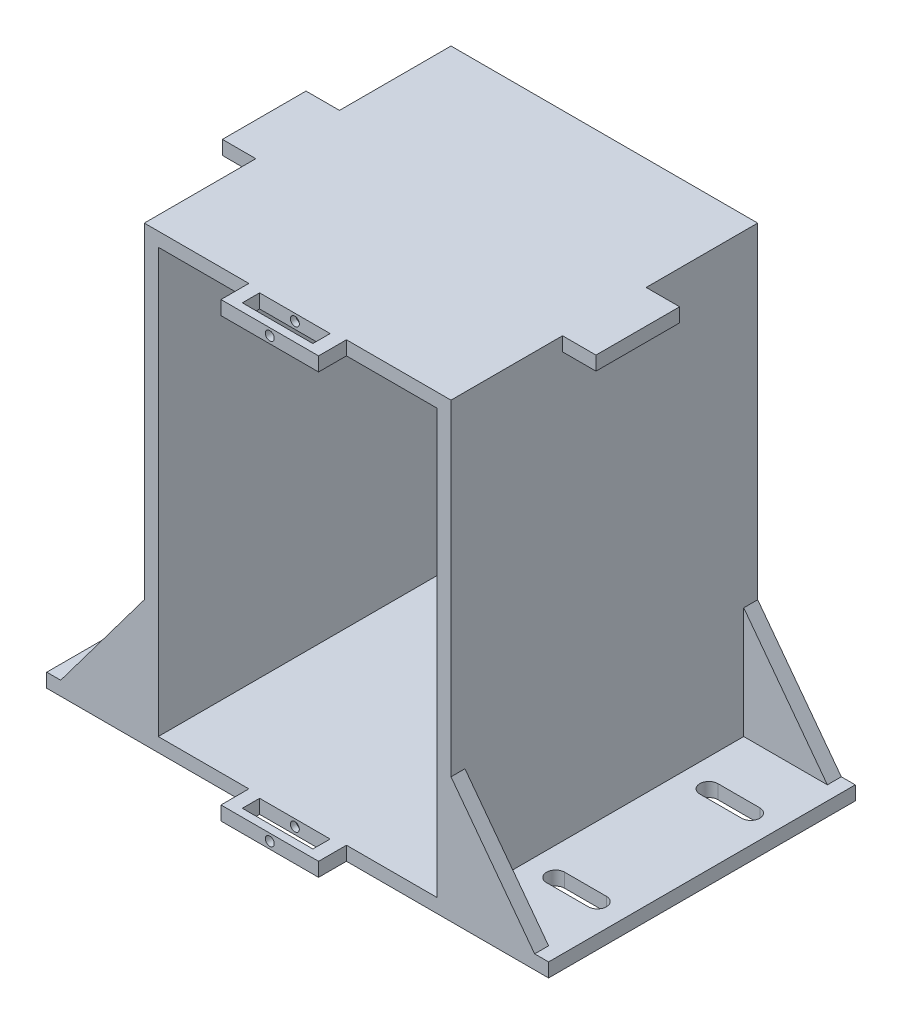
from build123d import *

# Parameters (mm, degrees)
SKETCH1_W           = 110
SKETCH1_H           = 162
BOSS_EXTRUDE1_DEPTH = 55
SHELL1_T            = -5
SKETCH2_W           = 35
SKETCH2_H           = 5
BOSS_EXTRUDE2_DEPTH = 55
BOSS_EXTRUDE3_DEPTH = 55
SKETCH12_W          = 35
SKETCH12_H          = 40
CUT_EXTRUDE5_DEPTH  = 50
CUT_EXTRUDE1_DEPTH  = 5
SKETCH6_W           = 12
SKETCH6_H           = 5
BOSS_EXTRUDE4_DEPTH = 15
SKETCH7_W           = 10
SKETCH7_H           = 5
BOSS_EXTRUDE5_DEPTH = 17.5
CUT_EXTRUDE2_START  = -162
SKETCH8_W           = 25.3
SKETCH8_H           = 6.2
CUT_EXTRUDE2_DEPTH  = 162
SKETCH9_R           = 1.6
CUT_EXTRUDE3_DEPTH  = 11


with BuildPart() as part:
    # Sketch1 → Boss-Extrude1 (new, symmetric)
    with BuildSketch(Plane.XY):
        Rectangle(SKETCH1_W, SKETCH1_H)
    extrude(amount=BOSS_EXTRUDE1_DEPTH, both=True)

    # Shell1
    shell1_openings = [part.faces().sort_by_distance(p)[0] for p in [
        (0, 0, 55),
    ]]
    offset(amount=SHELL1_T, openings=shell1_openings, kind=Kind.INTERSECTION)

    # Sketch2 → Boss-Extrude2 (add, symmetric)
    with BuildSketch(Plane.XY):
        with Locations((-72.5, -78.5)):
            Rectangle(SKETCH2_W, SKETCH2_H)
        with Locations((72.5, -78.5)):
            Rectangle(SKETCH2_W, SKETCH2_H)
    extrude(amount=BOSS_EXTRUDE2_DEPTH, both=True)

    # Sketch3 → Boss-Extrude3 (add, symmetric)
    with BuildSketch(Plane.XY):
        Polygon((-85, -76), (-55, -36), (-55, -76), align=None)
        Polygon((55, -36), (55, -76), (85, -76), align=None)
    extrude(amount=BOSS_EXTRUDE3_DEPTH, both=True)

    # Sketch12 → Cut-Extrude5 (cut, symmetric)
    with BuildSketch(Plane.XY):
        with Locations((-72.5, -56)):
            Rectangle(SKETCH12_W, SKETCH12_H)
        with Locations((72.5, -56)):
            Rectangle(SKETCH12_W, SKETCH12_H)
    extrude(amount=CUT_EXTRUDE5_DEPTH, both=True, mode=Mode.SUBTRACT)

    # Sketch5 → Cut-Extrude1 (cut)
    with BuildSketch(Plane(origin=(0, -76, 0), x_dir=(1, 0, 0), z_dir=(0, 1, 0))):
        with BuildLine():
            Line((-80, 30.75), (-65, 30.75))
            ThreePointArc((-65, 30.75), (-61.75, 27.5), (-65, 24.25))
            Line((-65, 24.25), (-80, 24.25))
            ThreePointArc((-80, 24.25), (-83.25, 27.5), (-80, 30.75))
        make_face()
        with BuildLine():
            Line((80, 30.75), (65, 30.75))
            ThreePointArc((65, 30.75), (61.75, 27.5), (65, 24.25))
            Line((65, 24.25), (80, 24.25))
            ThreePointArc((80, 24.25), (83.25, 27.5), (80, 30.75))
        make_face()
        with BuildLine():
            Line((80, -30.75), (65, -30.75))
            ThreePointArc((65, -30.75), (61.75, -27.5), (65, -24.25))
            Line((65, -24.25), (80, -24.25))
            ThreePointArc((80, -24.25), (83.25, -27.5), (80, -30.75))
        make_face()
        with BuildLine():
            Line((-80, -30.75), (-65, -30.75))
            ThreePointArc((-65, -30.75), (-61.75, -27.5), (-65, -24.25))
            Line((-65, -24.25), (-80, -24.25))
            ThreePointArc((-80, -24.25), (-83.25, -27.5), (-80, -30.75))
        make_face()
    extrude(amount=-CUT_EXTRUDE1_DEPTH, mode=Mode.SUBTRACT)

    # Sketch6 → Boss-Extrude4 (add, symmetric)
    with BuildSketch(Plane.XY):
        with Locations((-61, 78.5)):
            Rectangle(SKETCH6_W, SKETCH6_H)
        with Locations((61, 78.5)):
            Rectangle(SKETCH6_W, SKETCH6_H)
    extrude(amount=BOSS_EXTRUDE4_DEPTH, both=True)

    # Sketch7 → Boss-Extrude5 (add, symmetric)
    with BuildSketch(Plane(origin=(0, 0, 0), x_dir=(0, 0, -1), z_dir=(1, 0, 0))):
        with Locations((-60, 78.5)):
            Rectangle(SKETCH7_W, SKETCH7_H)
        with Locations((-60, -78.5)):
            Rectangle(SKETCH7_W, SKETCH7_H)
    extrude(amount=BOSS_EXTRUDE5_DEPTH, both=True)

    # Sketch8 → Cut-Extrude2 (cut)
    with BuildSketch(Plane(origin=(0, 81, 0), x_dir=(1, 0, 0), z_dir=(0, 1, 0)).offset(CUT_EXTRUDE2_START)):
        with Locations((0, -59.1)):
            Rectangle(SKETCH8_W, SKETCH8_H)
    extrude(amount=CUT_EXTRUDE2_DEPTH, mode=Mode.SUBTRACT)

    # Sketch9 → Cut-Extrude3 (cut)
    with BuildSketch(Plane.XY.offset(65)):
        with Locations((0, -78.5)):
            Circle(SKETCH9_R)
        with Locations(Location((0, 78.5, 0), (0, 0, 180))):
            Circle(SKETCH9_R)
    extrude(amount=-CUT_EXTRUDE3_DEPTH, mode=Mode.SUBTRACT)


solid = part.part
